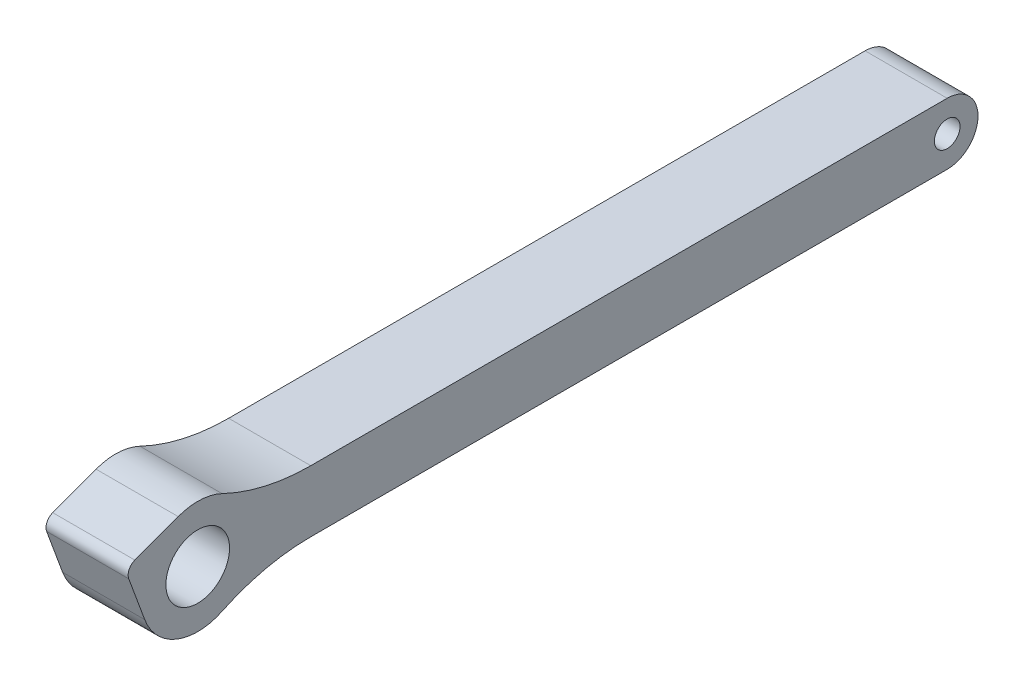
from build123d import *

# Parameters (mm, degrees)
SKETCH1_R           = 1.25
SKETCH1_R_2         = 3.1
BOSS_EXTRUDE1_DEPTH = 4


with BuildPart() as part:
    # Sketch1 → Boss-Extrude1 (new, symmetric)
    with BuildSketch(Plane(origin=(0, 0, 0), x_dir=(0, 0, -1), z_dir=(1, 0, 0))):
        with BuildLine():
            Line((-61.988642227, 3), (0, 3))
            ThreePointArc((0, 3), (3, 0), (0, -3))
            Line((0, -3), (-61.988642227, -3))
            ThreePointArc((-61.988642227, -3), (-66.416716655, -3.496355293), (-70.625001265, -4.960784314))
            ThreePointArc((-70.625001265, -4.960784314), (-75.069194472, -5.095923296), (-78.161118418, -1.900751608))
            Line((-78.161118418, -1.900751608), (-79.716278824, 2.321981644))
            ThreePointArc((-79.716278824, 2.321981644), (-79.685802054, 3.086741478), (-79.123484859, 3.605958012))
            Line((-79.123484859, 3.605958012), (-74.900751608, 5.161118418))
            ThreePointArc((-74.900751608, 5.161118418), (-72.742587835, 5.493972968), (-70.625001265, 4.960784314))
            ThreePointArc((-70.625001265, 4.960784314), (-66.416716655, 3.496355293), (-61.988642227, 3))
        make_face()
        Circle(SKETCH1_R, mode=Mode.SUBTRACT)
        with Locations((-73, 0)):
            Circle(SKETCH1_R_2, mode=Mode.SUBTRACT)
    extrude(amount=BOSS_EXTRUDE1_DEPTH, both=True)


solid = part.part
